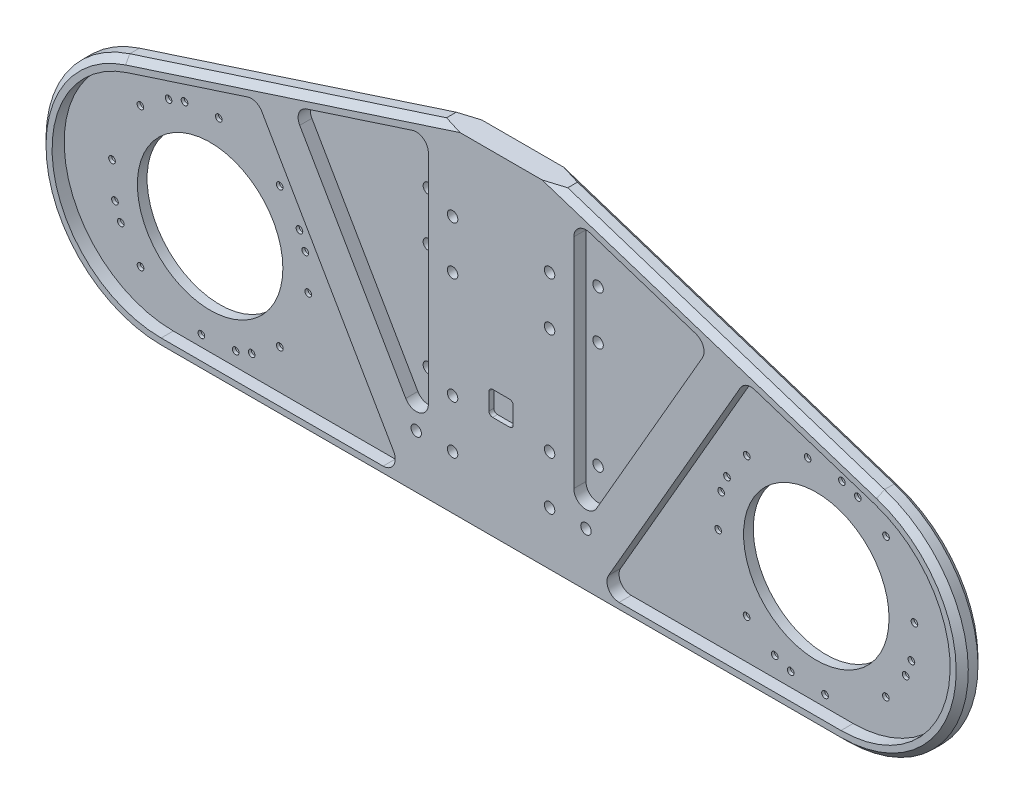
from build123d import *

# Parameters (mm, degrees)
SKETCH_1_R               = 60
EXTRUDE_1_DEPTH          = 8
FILLET_1_R               = 100
EXTRUDE_START            = 10
EXTRUDE_2_DEPTH          = 10
FILLET_2_R               = 10
CHAMFER_1_SIZE           = 5
CUT_EXTRUDE_1_DEPTH      = 514.758413114
CUT_EXTRUDE_1_DEPTH_BACK = 514.758413114
SKETCH_3_R               = 4.3
SKETCH_4_R               = 2.75
CUT_EXTRUDE_2_DEPTH      = 10
SKETCH_5_R               = 6
CUT_EXTRUDE_3_DEPTH      = 5.5
SKETCH_6_W               = 20
SKETCH_6_H               = 20
CUT_EXTRUDE_4_DEPTH      = 4
FILLET_3_R               = 3


with BuildPart() as part:
    # 草图1 → 凸台-拉伸1 (new body)
    with BuildSketch(Plane.XY):
        Polygon((0, 0), (-100, 0), (-961.751390409, 0), (-100, 280), (0, 280), (861.751390409, 0), align=None)
        with Locations((200, 100)):
            Circle(SKETCH_1_R, mode=Mode.SUBTRACT)
        with Locations((-300, 100)):
            Circle(SKETCH_1_R, mode=Mode.SUBTRACT)
    extrude(amount=EXTRUDE_1_DEPTH)

    # 圆角1
    fillet_1_edges = [part.edges().sort_by_distance(p)[0] for p in [
        (-961.751390409, 0, 4),
        (861.751390409, 0, 4),
    ]]
    fillet(fillet_1_edges, radius=FILLET_1_R)

    # 草图2 → 凸台-拉伸2 (add)
    # profile 1 of 2: a face of its own
    with BuildSketch(Plane.XY.offset(8).offset(EXTRUDE_START)):
        with BuildLine():
            Line((-50, 0), (-50, 280))
            Line((-50, 280), (-100, 280))
            Line((-100, 280), (-361.277938379, 195.10565163))
            ThreePointArc((-361.277938379, 195.10565163), (-429.145073001, 84.356553496), (-330.376238942, 0))
            Line((-330.376238942, 0), (-50, 0))
        make_face()
        with BuildLine():
            Line((-358.187768435, 185.595086467), (-251.410485182, 220.289128906))
            Line((-251.410485182, 220.289128906), (-130, 10))
            Line((-130, 10), (-330.376238942, 10))
            ThreePointArc((-330.376238942, 10), (-419.268189595, 85.920898146), (-358.187768435, 185.595086467))
        make_face(mode=Mode.SUBTRACT)
        Polygon((-110, 266.236180795), (-110, 35.358983849), (-222.241374643, 229.766747442), align=None, mode=Mode.SUBTRACT)
    # profile 2 of 2: a face of its own
    with BuildSketch(Plane.XY.offset(8).offset(EXTRUDE_START)):
        with BuildLine():
            Line((261.277938379, 195.10565163), (0, 280))
            Line((0, 280), (-50, 280))
            Line((-50, 280), (-50, 0))
            Line((-50, 0), (230.376238942, 0))
            ThreePointArc((230.376238942, 0), (329.145073001, 84.356553496), (261.277938379, 195.10565163))
        make_face()
        with BuildLine():
            Line((230.376238942, 10), (30, 10))
            Line((30, 10), (151.410485182, 220.289128906))
            Line((151.410485182, 220.289128906), (258.187768435, 185.595086467))
            ThreePointArc((258.187768435, 185.595086467), (319.268189595, 85.920898146), (230.376238942, 10))
        make_face(mode=Mode.SUBTRACT)
        Polygon((10, 35.358983849), (10, 266.236180795), (122.241374643, 229.766747442), align=None, mode=Mode.SUBTRACT)
    extrude(amount=-EXTRUDE_2_DEPTH)

    # 圆角2
    fillet_2_edges = [part.edges().sort_by_distance(p)[0] for p in [
        (122.241374643, 229.766747442, 13),
        (10, 35.358983849, 13),
        (30, 10, 13),
        (-130, 10, 13),
        (-222.241374643, 229.766747442, 13),
        (-110, 266.236180795, 13),
        (151.410485182, 220.289128906, 13),
        (-251.410485182, 220.289128906, 13),
        (-110, 35.358983849, 13),
        (10, 266.236180795, 13),
    ]]
    fillet(fillet_2_edges, radius=FILLET_2_R)

    # 倒角1
    chamfer_1_edges = [part.edges().sort_by_distance(p)[0] for p in [
        (130.63896919, 237.552825815, 0),
        (-50, 0, 0),
        (329.145073001, 84.356553496, 0),
        (-429.145073001, 84.356553496, 0),
        (-50, 0, 18),
        (329.145073001, 84.356553496, 18),
        (130.63896919, 237.552825815, 18),
        (-230.63896919, 237.552825815, 18),
        (-429.145073001, 84.356553496, 18),
        (-230.63896919, 237.552825815, 0),
    ]]
    chamfer(chamfer_1_edges, length=CHAMFER_1_SIZE)

    # 草图3 → 切除-拉伸1 (cut, two sides: drawn at the far end of the back side and taken through both)
    with BuildSketch(Plane(origin=(0, 0, 0), x_dir=(-1, 0, 0), z_dir=(0, 0, -1)).offset(-CUT_EXTRUDE_1_DEPTH_BACK)):
        with Locations((-20, 217)):
            Circle(SKETCH_3_R)
        with Locations((-20, 177)):
            Circle(SKETCH_3_R)
        with Locations((10, 217)):
            Circle(SKETCH_3_R)
        with Locations((10, 177)):
            Circle(SKETCH_3_R)
        with Locations((-20, 89)):
            Circle(SKETCH_3_R)
        with Locations((10, 89)):
            Circle(SKETCH_3_R)
        with Locations((-20, 49)):
            Circle(SKETCH_3_R)
        with Locations((10, 49)):
            Circle(SKETCH_3_R)
        with Locations(Location((90, 49, 0), (0, 0, 180))):
            Circle(SKETCH_3_R)
        with Locations(Location((120, 49, 0), (0, 0, 180))):
            Circle(SKETCH_3_R)
        with Locations(Location((90, 89, 0), (0, 0, 180))):
            Circle(SKETCH_3_R)
        with Locations(Location((120, 89, 0), (0, 0, 180))):
            Circle(SKETCH_3_R)
        with Locations(Location((90, 177, 0), (0, 0, 180))):
            Circle(SKETCH_3_R)
        with Locations(Location((90, 217, 0), (0, 0, 180))):
            Circle(SKETCH_3_R)
        with Locations(Location((120, 177, 0), (0, 0, 180))):
            Circle(SKETCH_3_R)
        with Locations(Location((120, 217, 0), (0, 0, 180))):
            Circle(SKETCH_3_R)
    extrude(amount=CUT_EXTRUDE_1_DEPTH + CUT_EXTRUDE_1_DEPTH_BACK, mode=Mode.SUBTRACT)

    # 草图4 → 切除-拉伸2 (cut)
    with BuildSketch(Plane.XY.offset(8)):
        with Locations((257.390001682, 42.485217492)):
            Circle(SKETCH_4_R)
        with Locations((273.674753309, 65.742253069)):
            Circle(SKETCH_4_R)
        with Locations((278.458590634, 78.885738097)):
            Circle(SKETCH_4_R)
        with Locations((280.933081449, 107.169297536)):
            Circle(SKETCH_4_R)
        with Locations((257.514782508, 157.390001682)):
            Circle(SKETCH_4_R)
        with Locations((234.257746931, 173.674753309)):
            Circle(SKETCH_4_R)
        with Locations((221.114261903, 178.458590634)):
            Circle(SKETCH_4_R)
        with Locations((192.830702464, 180.933081449)):
            Circle(SKETCH_4_R)
        with Locations((142.609998318, 157.514782508)):
            Circle(SKETCH_4_R)
        with Locations((126.325246691, 134.257746931)):
            Circle(SKETCH_4_R)
        with Locations((121.541409366, 121.114261903)):
            Circle(SKETCH_4_R)
        with Locations((119.066918551, 92.830702464)):
            Circle(SKETCH_4_R)
        with Locations((142.485217492, 42.609998318)):
            Circle(SKETCH_4_R)
        with Locations((165.742253069, 26.325246691)):
            Circle(SKETCH_4_R)
        with Locations((178.885738097, 21.541409366)):
            Circle(SKETCH_4_R)
        with Locations((-242.485217492, 42.609998318)):
            Circle(SKETCH_4_R)
        with Locations((-265.742253069, 26.325246691)):
            Circle(SKETCH_4_R)
        with Locations((-278.885738097, 21.541409366)):
            Circle(SKETCH_4_R)
        with Locations((-307.169297536, 19.066918551)):
            Circle(SKETCH_4_R)
        with Locations((-357.390001682, 42.485217492)):
            Circle(SKETCH_4_R)
        with Locations((-373.674753309, 65.742253069)):
            Circle(SKETCH_4_R)
        with Locations((-378.458590634, 78.885738097)):
            Circle(SKETCH_4_R)
        with Locations((-380.933081449, 107.169297536)):
            Circle(SKETCH_4_R)
        with Locations((-357.514782508, 157.390001682)):
            Circle(SKETCH_4_R)
        with Locations((-334.257746931, 173.674753309)):
            Circle(SKETCH_4_R)
        with Locations((-321.114261903, 178.458590634)):
            Circle(SKETCH_4_R)
        with Locations((-292.830702464, 180.933081449)):
            Circle(SKETCH_4_R)
        with Locations((-242.609998318, 157.514782508)):
            Circle(SKETCH_4_R)
        with Locations((-226.325246691, 134.257746931)):
            Circle(SKETCH_4_R)
        with Locations((-221.541409366, 121.114261903)):
            Circle(SKETCH_4_R)
        with Locations((-219.066918551, 92.830702464)):
            Circle(SKETCH_4_R)
        with Locations((207.169297536, 19.066918551)):
            Circle(SKETCH_4_R)
    extrude(amount=-CUT_EXTRUDE_2_DEPTH, mode=Mode.SUBTRACT)

    # 草图5 → 切除-拉伸3 (cut)
    with BuildSketch(Plane(origin=(0, 0, 0), x_dir=(-1, 0, 0), z_dir=(0, 0, -1))):
        with Locations((-192.830702464, 180.933081449)):
            Circle(SKETCH_5_R)
        with Locations((-142.609998318, 157.514782508)):
            Circle(SKETCH_5_R)
        with Locations((-126.325246691, 134.257746931)):
            Circle(SKETCH_5_R)
        with Locations((-121.541409366, 121.114261903)):
            Circle(SKETCH_5_R)
        with Locations((-119.066918551, 92.830702464)):
            Circle(SKETCH_5_R)
        with Locations((-142.485217492, 42.609998318)):
            Circle(SKETCH_5_R)
        with Locations((-165.742253069, 26.325246691)):
            Circle(SKETCH_5_R)
        with Locations((-178.885738097, 21.541409366)):
            Circle(SKETCH_5_R)
        with Locations((-207.169297536, 19.066918551)):
            Circle(SKETCH_5_R)
        with Locations((-257.390001682, 42.485217492)):
            Circle(SKETCH_5_R)
        with Locations((-273.674753309, 65.742253069)):
            Circle(SKETCH_5_R)
        with Locations((-278.458590634, 78.885738097)):
            Circle(SKETCH_5_R)
        with Locations((-280.933081449, 107.169297536)):
            Circle(SKETCH_5_R)
        with Locations((-257.514782508, 157.390001682)):
            Circle(SKETCH_5_R)
        with Locations((-234.257746931, 173.674753309)):
            Circle(SKETCH_5_R)
        with Locations((-221.114261903, 178.458590634)):
            Circle(SKETCH_5_R)
        with Locations(Location((321.114261903, 178.458590634, 0), (0, 0, 180))):
            Circle(SKETCH_5_R)
        with Locations(Location((334.257746931, 173.674753309, 0), (0, 0, 180))):
            Circle(SKETCH_5_R)
        with Locations(Location((357.514782508, 157.390001682, 0), (0, 0, 180))):
            Circle(SKETCH_5_R)
        with Locations(Location((380.933081449, 107.169297536, 0), (0, 0, 180))):
            Circle(SKETCH_5_R)
        with Locations(Location((378.458590634, 78.885738097, 0), (0, 0, 180))):
            Circle(SKETCH_5_R)
        with Locations(Location((373.674753309, 65.742253069, 0), (0, 0, 180))):
            Circle(SKETCH_5_R)
        with Locations(Location((357.390001682, 42.485217492, 0), (0, 0, 180))):
            Circle(SKETCH_5_R)
        with Locations(Location((307.169297536, 19.066918551, 0), (0, 0, 180))):
            Circle(SKETCH_5_R)
        with Locations(Location((278.885738097, 21.541409366, 0), (0, 0, 180))):
            Circle(SKETCH_5_R)
        with Locations(Location((265.742253069, 26.325246691, 0), (0, 0, 180))):
            Circle(SKETCH_5_R)
        with Locations(Location((242.485217492, 42.609998318, 0), (0, 0, 180))):
            Circle(SKETCH_5_R)
        with Locations(Location((219.066918551, 92.830702464, 0), (0, 0, 180))):
            Circle(SKETCH_5_R)
        with Locations(Location((221.541409366, 121.114261903, 0), (0, 0, 180))):
            Circle(SKETCH_5_R)
        with Locations(Location((226.325246691, 134.257746931, 0), (0, 0, 180))):
            Circle(SKETCH_5_R)
        with Locations(Location((242.609998318, 157.514782508, 0), (0, 0, 180))):
            Circle(SKETCH_5_R)
        with Locations(Location((292.830702464, 180.933081449, 0), (0, 0, 180))):
            Circle(SKETCH_5_R)
    extrude(amount=-CUT_EXTRUDE_3_DEPTH, mode=Mode.SUBTRACT)

    # 草图6 → 切除-拉伸4 (cut)
    with BuildSketch(Plane.XY.offset(18)):
        with Locations((-50, 100)):
            Rectangle(SKETCH_6_W, SKETCH_6_H)
    extrude(amount=-CUT_EXTRUDE_4_DEPTH, mode=Mode.SUBTRACT)

    # 圆角3
    fillet_3_edges = [part.edges().sort_by_distance(p)[0] for p in [
        (-60, 90, 16),
        (-60, 110, 16),
        (-40, 110, 16),
        (-40, 90, 16),
    ]]
    fillet(fillet_3_edges, radius=FILLET_3_R)


solid = part.part
